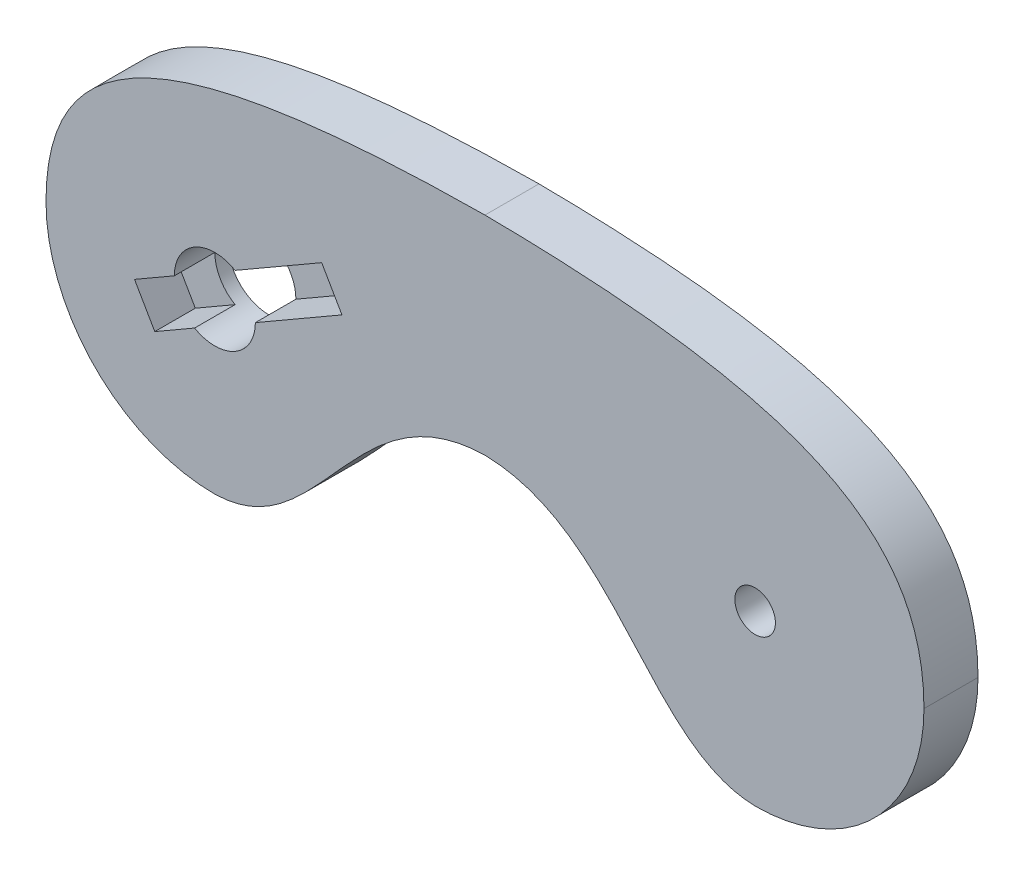
from build123d import *

# Parameters (mm, degrees)
SKETCH_1_R          = 1.5
SKETCH_1_R_2        = 3
EXTRUDE_1_DEPTH     = 4
CUT_EXTRUDE_2_DEPTH = 3


with BuildPart() as part:
    # 草图1 → 凸台-拉伸1 (new body)
    with BuildSketch(Plane.XY):
        with BuildLine():
            ThreePointArc((112.5, 0), (108.838834765, -8.838834765), (100, -12.5))
            add(Edge.make_bspline(
                [(100, -12.5), (92.140208688, -12.329014368), (89.825172612, -0.222632889), (80, 0)],
                knots=[0, 0, 0, 0, 1, 1, 1, 1], degree=3))
            add(Edge.make_bspline(
                [(60, -12.5), (67.859791312, -12.329014368), (70.174827388, -0.222632889), (80, 0)],
                knots=[0, 0, 0, 0, 1, 1, 1, 1], degree=3))
            ThreePointArc((60, -12.5), (51.161165235, -8.838834765), (47.5, 0))
            add(Edge.make_bspline(
                [(47.5, 0), (47.5, 11.115830806), (57.235300252, 15.170917893), (80, 15.396531985)],
                knots=[0, 0, 0, 0, 1, 1, 1, 1], degree=3))
            add(Edge.make_bspline(
                [(112.5, 0), (112.5, 11.115830806), (102.764699748, 15.170917893), (80, 15.396531985)],
                knots=[0, 0, 0, 0, 1, 1, 1, 1], degree=3))
        make_face()
        with Locations((100, 0)):
            Circle(SKETCH_1_R, mode=Mode.SUBTRACT)
        with Locations((60, 0)):
            Circle(SKETCH_1_R_2, mode=Mode.SUBTRACT)
    extrude(amount=EXTRUDE_1_DEPTH)

    # 草图5 → 切除-拉伸2 (cut)
    with BuildSketch(Plane.XY.offset(4)):
        Polygon((54.803847577, -3), (54.053847577, -1.700961894), (67.910254038, 6.299038106), (69.410254038, 3.700961894), (55.553847577, -4.299038106), align=None)
    extrude(amount=-CUT_EXTRUDE_2_DEPTH, mode=Mode.SUBTRACT)


solid = part.part
